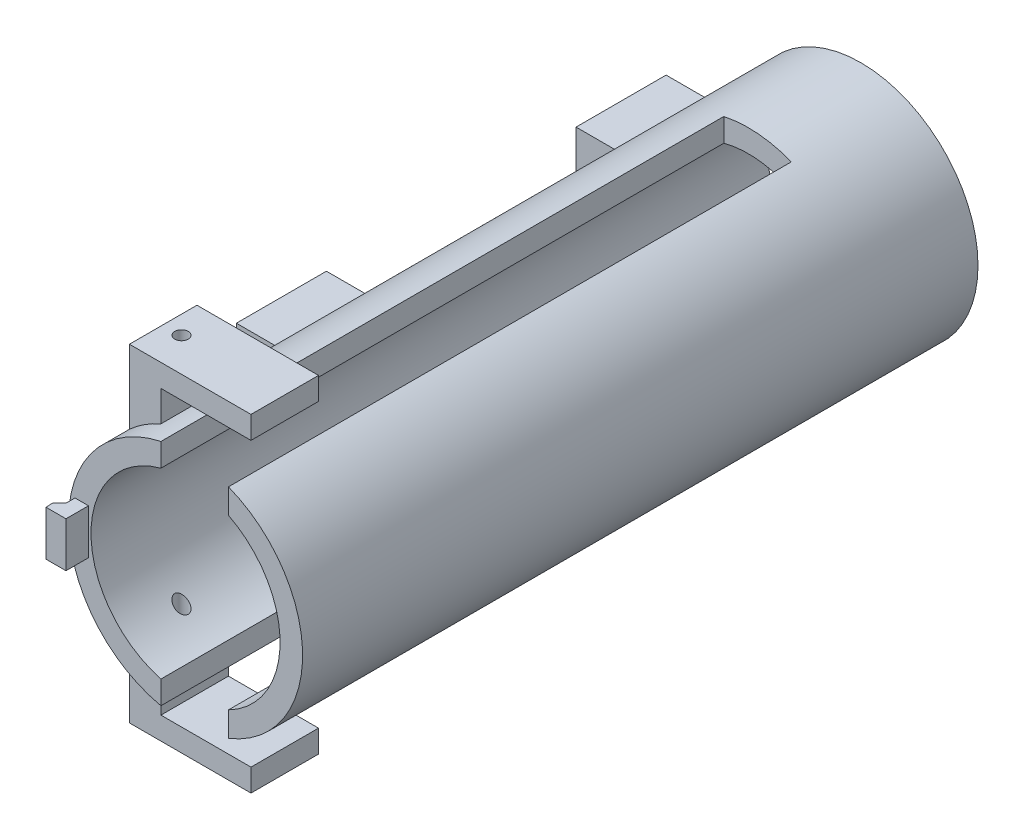
from build123d import *

# Parameters (mm, degrees)
ESBO_O1_R                     = 26
ESBO_O1_R_2                   = 21
RESSALTO_EXTRUS_O1_DEPTH      = 150
CORTE_EXTRUS_O1_DEPTH         = 162.271451737
CORTE_EXTRUS_O1_DEPTH_BACK    = 162.271451737
ESBO_O3_W                     = 125
ESBO_O3_H                     = 15
RESSALTO_EXTRUS_O2_REACH      = 163.271
RESSALTO_EXTRUS_O2_END_RADIUS = 26
ESBO_O4_W                     = 15
ESBO_O4_H                     = 7
ESBO_O5_W                     = 7
ESBO_O5_H                     = 15
RESSALTO_EXTRUS_O3_DEPTH      = 10
ESBO_O6_W                     = 15
ESBO_O6_H                     = 5
RESSALTO_EXTRUS_O4_DEPTH      = 20
RESSALTO_EXTRUS_O5_REACH      = 166.697
RESSALTO_EXTRUS_O5_END_RADIUS = 26
ESBO_O7_W                     = 15
ESBO_O7_H                     = 7
ESBO_O8_W                     = 7
ESBO_O8_H                     = 15
RESSALTO_EXTRUS_O6_DEPTH      = 10
ESBO_O9_W                     = 15
ESBO_O9_H                     = 5
RESSALTO_EXTRUS_O7_DEPTH      = 20
CORTE_EXTRUS_O2_DEPTH         = 169.765720645
CORTE_EXTRUS_O2_DEPTH_BACK    = 169.765720645
ESBO_O10_R                    = 1.5
RESSALTO_EXTRUS_O8_REACH      = 165.06
RESSALTO_EXTRUS_O8_END_RADIUS = 26
ESBO_O14_W                    = 15
ESBO_O14_H                    = 20
ESBO_O15_R                    = 1.75
CORTE_EXTRUS_O3_DEPTH         = 15
CORTE_EXTRUS_O4_DEPTH         = 3
CORTE_EXTRUS_O4_DEPTH_BACK    = 18
ESBO_O17_R                    = 1.75
CORTE_EXTRUS_O5_START         = -41.1
CORTE_EXTRUS_O5_DEPTH         = 3.5
ESBO_O19_W                    = 3
ESBO_O19_H                    = 5
RESSALTO_EXTRUS_O9_DEPTH      = 5
RESSALTO_EXTRUS_O10_DEPTH     = 10
CORTE_EXTRUS_O6_DEPTH         = 163.586633287


with BuildPart() as part:
    # Esboço1 → Ressalto-extrusão1 (new body)
    with BuildSketch(Plane.XY):
        Circle(ESBO_O1_R)
        Circle(ESBO_O1_R_2, mode=Mode.SUBTRACT)
    extrude(amount=RESSALTO_EXTRUS_O1_DEPTH)

    # Esboço3 → Corte-extrusão1 (cut, two sides: drawn at the far end of the back side and taken through both)
    with BuildSketch(Plane(origin=(0, -27.221059229, 0), x_dir=(0, 0, -1), z_dir=(0, -1, 0)).offset(-CORTE_EXTRUS_O1_DEPTH_BACK)):
        with Locations((-87.5, 2.034407051)):
            Rectangle(ESBO_O3_W, ESBO_O3_H)
    extrude(amount=CORTE_EXTRUS_O1_DEPTH + CORTE_EXTRUS_O1_DEPTH_BACK, mode=Mode.SUBTRACT)

    # Ressalto-extrusão2: up to this cylinder (the profile starts outside it)
    ressalto_extrus_o2_end = Plane(origin=(0, 0, 137.5), z_dir=(0, 0, -1)) * Cylinder(RESSALTO_EXTRUS_O2_END_RADIUS, 379.542, mode=Mode.PRIVATE)
    # Esboço4 → Ressalto-extrusão2 (add, up to the surface)
    with BuildSketch(Plane(origin=(0, -27.221059229, 0), x_dir=(0, 0, -1), z_dir=(0, -1, 0)), mode=Mode.PRIVATE) as ressalto_extrus_o2_sk1:
        with Locations((-137.5, -13.965592949)):
            Rectangle(ESBO_O4_W, ESBO_O4_H)
    ressalto_extrus_o2_tool1 = extrude(ressalto_extrus_o2_sk1.sketch, amount=-RESSALTO_EXTRUS_O2_REACH, mode=Mode.PRIVATE) - ressalto_extrus_o2_end
    add(ressalto_extrus_o2_tool1.solids().sort_by_distance((-13.965593, -27.221059, 137.5))[0])

    # Esboço5 → Ressalto-extrusão3 (add)
    with BuildSketch(Plane.XZ.offset(27.221059229)):
        with Locations((-13.965592949, 137.5)):
            Rectangle(ESBO_O5_W, ESBO_O5_H)
    extrude(amount=RESSALTO_EXTRUS_O3_DEPTH)

    # Esboço6 → Ressalto-extrusão4 (add)
    with BuildSketch(Plane(origin=(-10.465592949, 0, 0), x_dir=(0, 0, -1), z_dir=(1, 0, 0))):
        with Locations((-137.5, -34.721059229)):
            Rectangle(ESBO_O6_W, ESBO_O6_H)
    extrude(amount=RESSALTO_EXTRUS_O4_DEPTH)

    # Ressalto-extrusão5: up to this cylinder (the profile starts outside it)
    ressalto_extrus_o5_end = Plane(origin=(0, 0, 137.5), z_dir=(0, 0, -1)) * Cylinder(RESSALTO_EXTRUS_O5_END_RADIUS, 386.394, mode=Mode.PRIVATE)
    # Esboço7 → Ressalto-extrusão5 (add, up to the surface)
    with BuildSketch(Plane.ZX.offset(25.620333295), mode=Mode.PRIVATE) as ressalto_extrus_o5_sk1:
        with Locations((137.5, -13.965592949)):
            Rectangle(ESBO_O7_W, ESBO_O7_H)
    ressalto_extrus_o5_tool1 = extrude(ressalto_extrus_o5_sk1.sketch, amount=-RESSALTO_EXTRUS_O5_REACH, mode=Mode.PRIVATE) - ressalto_extrus_o5_end
    add(ressalto_extrus_o5_tool1.solids().sort_by_distance((-13.965593, 25.620333, 137.5))[0])

    # Esboço8 → Ressalto-extrusão6 (add)
    with BuildSketch(Plane(origin=(0, 25.620333295, 0), x_dir=(1, 0, 0), z_dir=(0, 1, 0))):
        with Locations((-13.965592949, -137.5)):
            Rectangle(ESBO_O8_W, ESBO_O8_H)
    extrude(amount=RESSALTO_EXTRUS_O6_DEPTH)

    # Esboço9 → Ressalto-extrusão7 (add)
    with BuildSketch(Plane(origin=(-10.465592949, 0, 0), x_dir=(0, 0, -1), z_dir=(1, 0, 0))):
        with Locations((-137.5, 33.120333295)):
            Rectangle(ESBO_O9_W, ESBO_O9_H)
    extrude(amount=RESSALTO_EXTRUS_O7_DEPTH)

    # Esboço10 → Corte-extrusão2 (cut, two sides: drawn at the far end of the back side and taken through both)
    with BuildSketch(Plane.XZ.offset(37.221059229).offset(-CORTE_EXTRUS_O2_DEPTH_BACK)):
        with Locations((-13.4052452, 137.5)):
            Circle(ESBO_O10_R)
    extrude(amount=CORTE_EXTRUS_O2_DEPTH + CORTE_EXTRUS_O2_DEPTH_BACK, mode=Mode.SUBTRACT)

    # Ressalto-extrusão8: up to this cylinder (the profile starts outside it)
    ressalto_extrus_o8_end = Plane(origin=(0, 0, 65), z_dir=(0, 0, -1)) * Cylinder(RESSALTO_EXTRUS_O8_END_RADIUS, 458.562278, mode=Mode.PRIVATE)
    # Esboço14 → Ressalto-extrusão8 (add, up to the surface)
    with BuildSketch(Plane(origin=(-25.991571687, 0, 0), x_dir=(0, -1, 0), z_dir=(-1, 0, 0)), mode=Mode.PRIVATE) as ressalto_extrus_o8_sk1:
        with Locations((-11.76014182, 102.721139131)):
            Rectangle(ESBO_O14_W, ESBO_O14_H)
    ressalto_extrus_o8_tool1 = extrude(ressalto_extrus_o8_sk1.sketch, amount=-RESSALTO_EXTRUS_O8_REACH, mode=Mode.PRIVATE) - ressalto_extrus_o8_end
    add(ressalto_extrus_o8_tool1.solids().sort_by_distance((-25.991572, 11.760142, 102.721139))[0])
    # Esboço14 → Ressalto-extrusão8 (add, up to the surface)
    with BuildSketch(Plane(origin=(-25.991571687, 0, 0), x_dir=(0, -1, 0), z_dir=(-1, 0, 0)), mode=Mode.PRIVATE) as ressalto_extrus_o8_sk2:
        with Locations((11.76014182, 102.721139131)):
            Rectangle(ESBO_O14_W, ESBO_O14_H)
    ressalto_extrus_o8_tool2 = extrude(ressalto_extrus_o8_sk2.sketch, amount=-RESSALTO_EXTRUS_O8_REACH, mode=Mode.PRIVATE) - ressalto_extrus_o8_end
    add(ressalto_extrus_o8_tool2.solids().sort_by_distance((-25.991572, -11.760142, 102.721139))[0])
    # Esboço14 → Ressalto-extrusão8 (add, up to the surface)
    with BuildSketch(Plane(origin=(-25.991571687, 0, 0), x_dir=(0, -1, 0), z_dir=(-1, 0, 0)), mode=Mode.PRIVATE) as ressalto_extrus_o8_sk3:
        with Locations((11.76014182, 27.278860869)):
            Rectangle(ESBO_O14_W, ESBO_O14_H)
    ressalto_extrus_o8_tool3 = extrude(ressalto_extrus_o8_sk3.sketch, amount=-RESSALTO_EXTRUS_O8_REACH, mode=Mode.PRIVATE) - ressalto_extrus_o8_end
    add(ressalto_extrus_o8_tool3.solids().sort_by_distance((-25.991572, -11.760142, 27.278861))[0])
    # Esboço14 → Ressalto-extrusão8 (add, up to the surface)
    with BuildSketch(Plane(origin=(-25.991571687, 0, 0), x_dir=(0, -1, 0), z_dir=(-1, 0, 0)), mode=Mode.PRIVATE) as ressalto_extrus_o8_sk4:
        with Locations((-11.76014182, 27.278860869)):
            Rectangle(ESBO_O14_W, ESBO_O14_H)
    ressalto_extrus_o8_tool4 = extrude(ressalto_extrus_o8_sk4.sketch, amount=-RESSALTO_EXTRUS_O8_REACH, mode=Mode.PRIVATE) - ressalto_extrus_o8_end
    add(ressalto_extrus_o8_tool4.solids().sort_by_distance((-25.991572, 11.760142, 27.278861))[0])

    # Esboço15 → Corte-extrusão3 (cut)
    with BuildSketch(Plane.ZY.offset(25.991571687)):
        with Locations((27.278860869, 11.76014182)):
            Circle(ESBO_O15_R)
        with Locations((102.721139131, 11.76014182)):
            Circle(ESBO_O15_R)
        with Locations((102.721139131, -11.76014182)):
            Circle(ESBO_O15_R)
        with Locations((27.278860869, -11.76014182)):
            Circle(ESBO_O15_R)
    extrude(amount=-CORTE_EXTRUS_O3_DEPTH, mode=Mode.SUBTRACT)

    # Esboço17 → Corte-extrusão4 (cut, two sides: drawn at the far end of the back side and taken through both)
    with BuildSketch(Plane(origin=(0, -27.221059229, 0), x_dir=(0, 0, -1), z_dir=(0, -1, 0)).offset(-CORTE_EXTRUS_O4_DEPTH_BACK)):
        with Locations(Location((-19, 2.034407051, 0), (0, 0, 90))):
            Circle(ESBO_O17_R)
        with Locations(Location((-6, 2.034407051, 0), (0, 0, 90))):
            Circle(ESBO_O17_R)
    extrude(amount=CORTE_EXTRUS_O4_DEPTH + CORTE_EXTRUS_O4_DEPTH_BACK, mode=Mode.SUBTRACT)

    # Esboço18 → Corte-extrusão5 (cut)
    with BuildSketch(Plane.ZX.offset(20.835810462).offset(CORTE_EXTRUS_O5_START)):
        Polygon((9, 0.302356243), (9, 3.766457858), (6, 5.498508666), (3, 3.766457858), (3, 0.302356243), (6, -1.429694564), align=None)
        Polygon((21.989029976, 3.785321041), (18.978178993, 5.498439938), (15.989149016, 3.747525948), (16.010970024, 0.283493061), (19.021821007, -1.429625836), (22.010850984, 0.321288154), align=None)
    extrude(amount=-CORTE_EXTRUS_O5_DEPTH, mode=Mode.SUBTRACT)

    # Esboço19 → Ressalto-extrusão9 (add)
    with BuildSketch(Plane.XY.offset(150)):
        with Locations((-23.057246572, 2.5)):
            Rectangle(ESBO_O19_W, ESBO_O19_H)
        with Locations((-23.057246572, -2.5)):
            Rectangle(ESBO_O19_W, ESBO_O19_H)
    extrude(amount=RESSALTO_EXTRUS_O9_DEPTH)

    # Esboço20 → Ressalto-extrusão10 (add)
    with BuildSketch(Plane(origin=(0, 5, 0), x_dir=(1, 0, 0), z_dir=(0, 1, 0))):
        Polygon((-24.557246572, -155), (-24.557246572, -152), (-27.557246572, -155), align=None)
    extrude(amount=-RESSALTO_EXTRUS_O10_DEPTH)

    # Esboço23 → Corte-extrusão6 (cut, through all)
    with BuildSketch(Plane.XZ.offset(5)):
        Polygon((-27.557246572, 155), (-25.991571687, 155), (-26.057246572, 153.5), align=None)
    extrude(amount=-CORTE_EXTRUS_O6_DEPTH, mode=Mode.SUBTRACT)


solid = part.part
